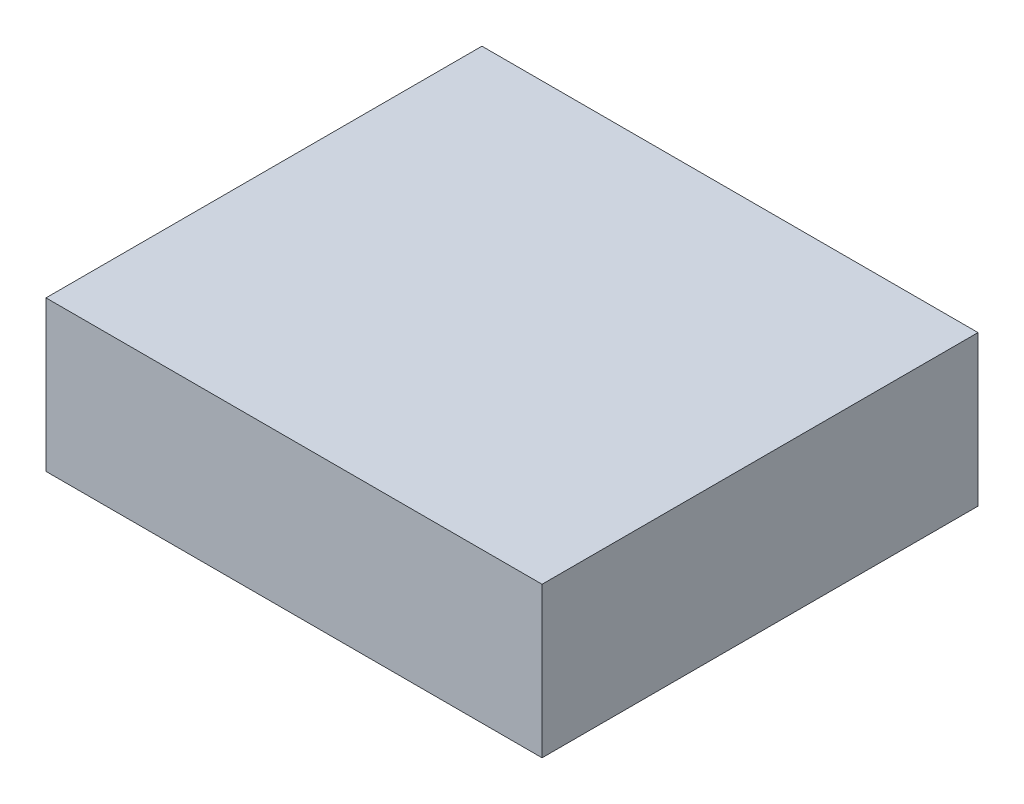
from build123d import *

# Parameters (mm, degrees)
SKETCH_1_W      = 33
SKETCH_1_H      = 29
EXTRUDE_1_DEPTH = 10


with BuildPart() as part:
    # Эскиз1 → Бобышка-Вытянуть1 (new body)
    with BuildSketch(Plane(origin=(0, 0, 0), x_dir=(1, 0, 0), z_dir=(0, 1, 0))):
        Rectangle(SKETCH_1_W, SKETCH_1_H)
    extrude(amount=EXTRUDE_1_DEPTH)


solid = part.part
